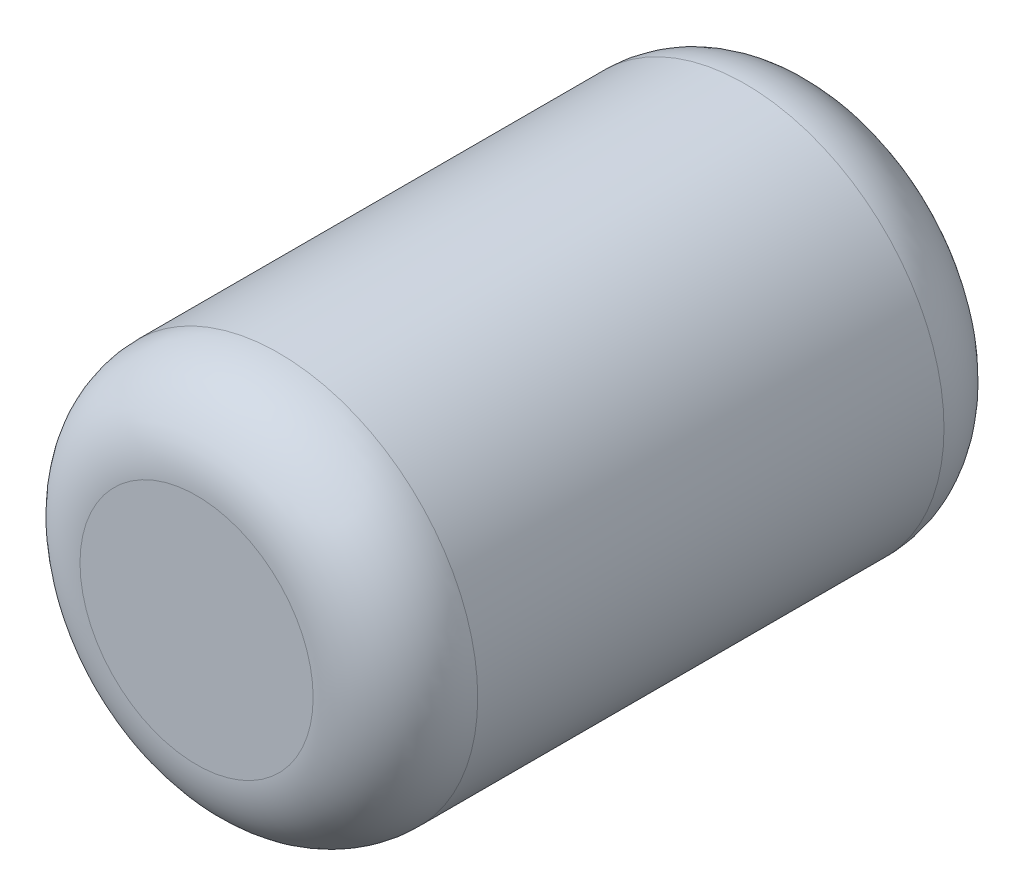
from build123d import *

# Parameters (mm, degrees)
SKETCH2_R           = 7.25
BOSS_EXTRUDE1_DEPTH = 23
FILLET1_R           = 3


with BuildPart() as part:
    # Sketch2 → Boss-Extrude1 (new body)
    with BuildSketch(Plane.XY):
        Circle(SKETCH2_R)
    extrude(amount=BOSS_EXTRUDE1_DEPTH)

    # Fillet1
    fillet1_edges = [part.edges().sort_by_distance(p)[0] for p in [
        (-7.25, 0, 0),
        (-7.25, 0, 23),
    ]]
    fillet(fillet1_edges, radius=FILLET1_R)


solid = part.part
